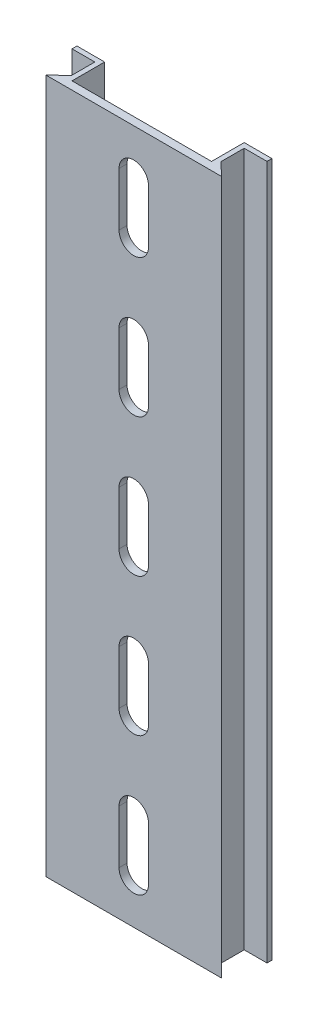
from build123d import *

# Parameters (mm, degrees)
BOSS_EXTRUDE1_DEPTH = 62.865
CUT_EXTRUDE1_DEPTH  = 66.710688552


with BuildPart() as part:
    # Sketch1 → Boss-Extrude1 (new, symmetric)
    with BuildSketch(Plane(origin=(0, 0, 0), x_dir=(1, 0, 0), z_dir=(0, 1, 0))):
        Polygon((-15.875, 0), (0, 0), (0, 1.4478), (-12.6365, 1.4478), (-12.6365, 7.366), (-17.653, 7.366), (-17.653, 6.477), (-13.5255, 6.477), (-13.5255, 2.286), align=None)
        Polygon((0, 1.4478), (0, 0), (15.875, 0), (13.5255, 2.286), (13.5255, 6.477), (17.653, 6.477), (17.653, 7.366), (12.6365, 7.366), (12.6365, 1.4478), align=None)
    extrude(amount=BOSS_EXTRUDE1_DEPTH, both=True)

    # Sketch2 → Cut-Extrude1 (cut, through all)
    with BuildSketch(Plane.XY):
        with BuildLine():
            Line((-2.667, -4.833), (-2.667, 4.833))
            ThreePointArc((-2.667, 4.833), (0, 7.5), (2.667, 4.833))
            Line((2.667, 4.833), (2.667, -4.833))
            ThreePointArc((2.667, -4.833), (0, -7.5), (-2.667, -4.833))
        make_face()
        with BuildLine():
            Line((-2.667, 20.167), (-2.667, 29.833))
            ThreePointArc((-2.667, 29.833), (0, 32.5), (2.667, 29.833))
            Line((2.667, 29.833), (2.667, 20.167))
            ThreePointArc((2.667, 20.167), (0, 17.5), (-2.667, 20.167))
        make_face()
        with BuildLine():
            Line((-2.667, 45.167), (-2.667, 54.833))
            ThreePointArc((-2.667, 54.833), (0, 57.5), (2.667, 54.833))
            Line((2.667, 54.833), (2.667, 45.167))
            ThreePointArc((2.667, 45.167), (0, 42.5), (-2.667, 45.167))
        make_face()
        with BuildLine():
            Line((-2.667, -29.833), (-2.667, -20.167))
            ThreePointArc((-2.667, -20.167), (0, -17.5), (2.667, -20.167))
            Line((2.667, -20.167), (2.667, -29.833))
            ThreePointArc((2.667, -29.833), (0, -32.5), (-2.667, -29.833))
        make_face()
        with BuildLine():
            Line((-2.667, -54.833), (-2.667, -45.167))
            ThreePointArc((-2.667, -45.167), (0, -42.5), (2.667, -45.167))
            Line((2.667, -45.167), (2.667, -54.833))
            ThreePointArc((2.667, -54.833), (0, -57.5), (-2.667, -54.833))
        make_face()
    extrude(amount=-CUT_EXTRUDE1_DEPTH, mode=Mode.SUBTRACT)


solid = part.part
